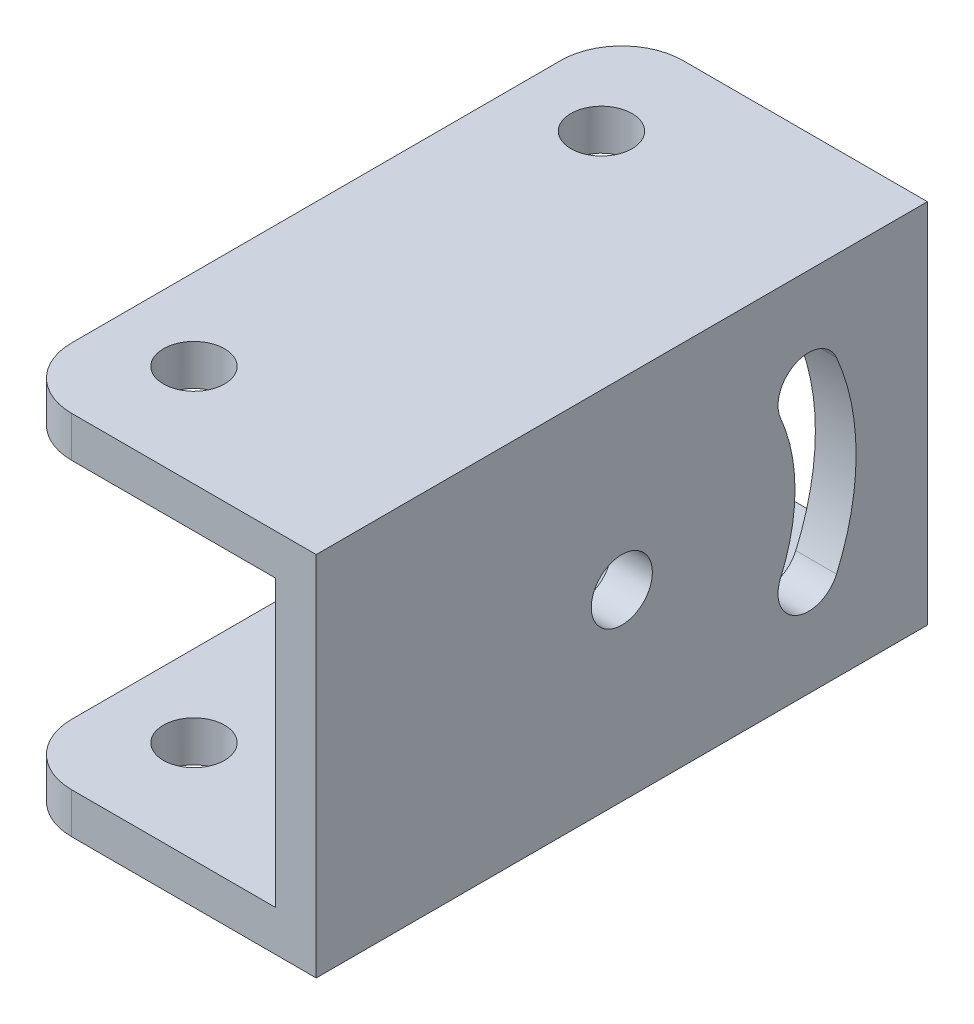
from build123d import *

# Parameters (mm, degrees)
BOSS_EXTRUDE1_DEPTH = 30
SKETCH2_R           = 1.5
CUT_EXTRUDE1_DEPTH  = 39.065732621
FILLET1_R           = 3
SKETCH3_R           = 1.5
CUT_EXTRUDE2_DEPTH  = 30


with BuildPart() as part:
    # Sketch1 → Boss-Extrude1 (new body)
    with BuildSketch(Plane.XY):
        Polygon((0, 0), (15, 0), (15, 18), (0, 18), (0, 16), (13, 16), (13, 2), (0, 2), align=None)
    extrude(amount=BOSS_EXTRUDE1_DEPTH)

    # Sketch2 → Cut-Extrude1 (cut, through all)
    with BuildSketch(Plane(origin=(0, 18, 0), x_dir=(1, 0, 0), z_dir=(0, 1, 0))):
        with Locations(Location((4, -5, 0), (0, 0, 270))):
            Circle(SKETCH2_R)
        with Locations(Location((4, -25, 0), (0, 0, 270))):
            Circle(SKETCH2_R)
    extrude(amount=-CUT_EXTRUDE1_DEPTH, mode=Mode.SUBTRACT)

    # Fillet1
    fillet1_edges = [part.edges().sort_by_distance(p)[0] for p in [
        (0, 1, 0),
        (0, 17, 30),
        (0, 1, 30),
        (0, 17, 0),
    ]]
    fillet(fillet1_edges, radius=FILLET1_R)

    # Sketch3 → Cut-Extrude2 (cut)
    with BuildSketch(Plane(origin=(15, 0, 0), x_dir=(0, 0, -1), z_dir=(1, 0, 0))):
        with Locations((-15, 9)):
            Circle(SKETCH3_R)
        with BuildLine():
            ThreePointArc((-4.460075902, 4.4), (-3.5, 9), (-4.460075902, 13.6))
            ThreePointArc((-4.460075902, 13.6), (-6.43484861, 14.374772708), (-7.209621319, 12.4))
            ThreePointArc((-7.209621319, 12.4), (-6.5, 9), (-7.209621319, 5.6))
            ThreePointArc((-7.209621319, 5.6), (-6.43484861, 3.625227292), (-4.460075902, 4.4))
        make_face()
    extrude(amount=-CUT_EXTRUDE2_DEPTH, mode=Mode.SUBTRACT)


solid = part.part
